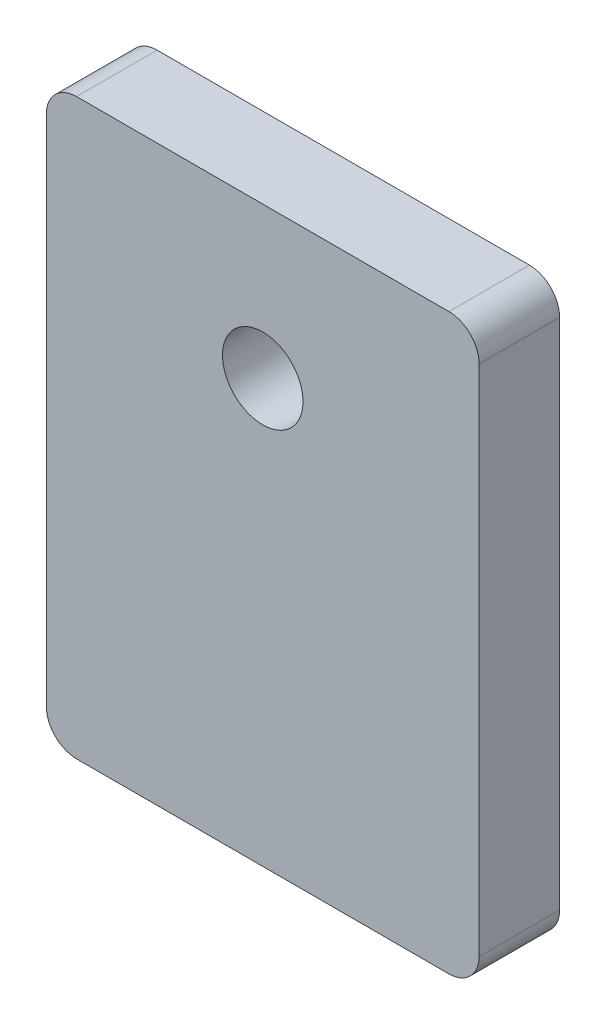
from build123d import *

# Parameters (mm, degrees)
SKETCH1_W           = 43
SKETCH1_H           = 57
BOSS_EXTRUDE1_DEPTH = 4
SKETCH2_R           = 4
CUT_EXTRUDE1_DEPTH  = 37.58551626
FILLET1_R           = 3


with BuildPart() as part:
    # Sketch1 → Boss-Extrude1 (new, symmetric)
    with BuildSketch(Plane.XY):
        Rectangle(SKETCH1_W, SKETCH1_H)
    extrude(amount=BOSS_EXTRUDE1_DEPTH, both=True)

    # Sketch2 → Cut-Extrude1 (cut, through all)
    with BuildSketch(Plane.XY.offset(4)):
        with Locations((0, 13.5)):
            Circle(SKETCH2_R)
    extrude(amount=-CUT_EXTRUDE1_DEPTH, mode=Mode.SUBTRACT)

    # Fillet1
    fillet1_edges = [part.edges().sort_by_distance(p)[0] for p in [
        (21.5, -28.5, 0),
        (-21.5, -28.5, 0),
        (-21.5, 28.5, 0),
        (21.5, 28.5, 0),
    ]]
    fillet(fillet1_edges, radius=FILLET1_R)


solid = part.part
